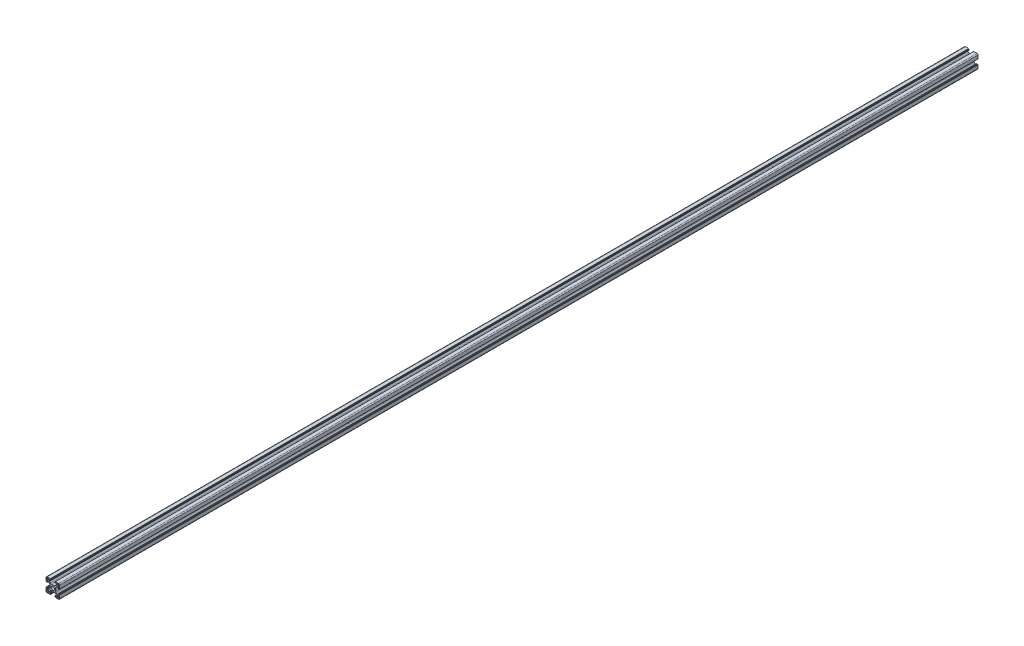
from build123d import *

# Parameters (mm, degrees)
EXTRUDE_1_DEPTH = 1350


with BuildPart() as part:
    # Эскиз1 → Бобышка-Вытянуть1 (new body)
    with BuildSketch(Plane.XY):
        with BuildLine():
            Line((-34.993325654, 64.172801362), (-33.094544985, 64.172801362))
            ThreePointArc((-33.094544985, 64.172801362), (-32.32917812, 64.325042297), (-31.680331423, 64.758587799))
            Line((-31.680331423, 64.758587799), (-30.379112092, 66.05980713))
            ThreePointArc((-30.379112092, 66.05980713), (-29.945566589, 66.708653828), (-29.793325654, 67.474020692))
            Line((-29.793325654, 67.474020692), (-29.793325654, 68.372801362))
            ThreePointArc((-29.793325654, 68.372801362), (-29.939772264, 68.726354752), (-30.293325654, 68.872801362))
            Line((-30.293325654, 68.872801362), (-30.396218873, 68.872801362))
            ThreePointArc((-30.396218873, 68.872801362), (-30.587560589, 68.834741128), (-30.749772264, 68.726354752))
            Line((-30.749772264, 68.726354752), (-31.23010235, 68.246024666))
            ThreePointArc((-31.23010235, 68.246024666), (-31.311208187, 68.191831478), (-31.406879045, 68.172801362))
            Line((-31.406879045, 68.172801362), (-31.693325654, 68.172801362))
            ThreePointArc((-31.693325654, 68.172801362), (-31.87010235, 68.246024666), (-31.943325654, 68.422801362))
            Line((-31.943325654, 68.422801362), (-31.943325654, 69.571872182))
            ThreePointArc((-31.943325654, 69.571872182), (-31.899391671, 69.677938199), (-31.793325654, 69.721872182))
            Line((-31.793325654, 69.721872182), (-31.293325654, 69.721872182))
            Line((-31.293325654, 69.721872182), (-31.293325654, 70.022801362))
            ThreePointArc((-31.293325654, 70.022801362), (-31.249391671, 70.128867379), (-31.143325654, 70.172801362))
            Line((-31.143325654, 70.172801362), (-26.493325654, 70.172801362))
            ThreePointArc((-26.493325654, 70.172801362), (-25.432665483, 69.733461533), (-24.993325654, 68.672801362))
            Line((-24.993325654, 68.672801362), (-24.993325654, 64.022801362))
            ThreePointArc((-24.993325654, 64.022801362), (-25.037259637, 63.916735344), (-25.143325654, 63.872801362))
            Line((-25.143325654, 63.872801362), (-25.444254834, 63.872801362))
            Line((-25.444254834, 63.872801362), (-25.444254834, 63.372801362))
            ThreePointArc((-25.444254834, 63.372801362), (-25.488188817, 63.266735344), (-25.594254834, 63.222801362))
            Line((-25.594254834, 63.222801362), (-26.743325654, 63.222801362))
            ThreePointArc((-26.743325654, 63.222801362), (-26.92010235, 63.296024666), (-26.993325654, 63.472801362))
            Line((-26.993325654, 63.472801362), (-26.993325654, 63.759247971))
            ThreePointArc((-26.993325654, 63.759247971), (-26.974295537, 63.854918829), (-26.92010235, 63.936024666))
            Line((-26.92010235, 63.936024666), (-26.439772264, 64.416354752))
            ThreePointArc((-26.439772264, 64.416354752), (-26.331385888, 64.578566427), (-26.293325654, 64.769908143))
            Line((-26.293325654, 64.769908143), (-26.293325654, 64.872801362))
            ThreePointArc((-26.293325654, 64.872801362), (-26.439772264, 65.226354752), (-26.793325654, 65.372801362))
            Line((-26.793325654, 65.372801362), (-27.692106323, 65.372801362))
            ThreePointArc((-27.692106323, 65.372801362), (-28.457473188, 65.220560427), (-29.106319886, 64.787014924))
            Line((-29.106319886, 64.787014924), (-30.407539217, 63.485795593))
            ThreePointArc((-30.407539217, 63.485795593), (-30.841084719, 62.836948895), (-30.993325654, 62.071582031))
            Line((-30.993325654, 62.071582031), (-30.993325654, 60.172801362))
            Line((-30.993325654, 60.172801362), (-30.993325654, 58.274020692))
            ThreePointArc((-30.993325654, 58.274020692), (-30.841084719, 57.508653828), (-30.407539217, 56.85980713))
            Line((-30.407539217, 56.85980713), (-29.106319886, 55.558587799))
            ThreePointArc((-29.106319886, 55.558587799), (-28.457473188, 55.125042297), (-27.692106323, 54.972801362))
            Line((-27.692106323, 54.972801362), (-26.793325654, 54.972801362))
            ThreePointArc((-26.793325654, 54.972801362), (-26.439772264, 55.119247971), (-26.293325654, 55.472801362))
            Line((-26.293325654, 55.472801362), (-26.293325654, 55.57569458))
            ThreePointArc((-26.293325654, 55.57569458), (-26.331385888, 55.767036297), (-26.439772264, 55.929247971))
            Line((-26.439772264, 55.929247971), (-26.92010235, 56.409578057))
            ThreePointArc((-26.92010235, 56.409578057), (-26.974295537, 56.490683894), (-26.993325654, 56.586354752))
            Line((-26.993325654, 56.586354752), (-26.993325654, 56.872801362))
            ThreePointArc((-26.993325654, 56.872801362), (-26.92010235, 57.049578057), (-26.743325654, 57.122801362))
            Line((-26.743325654, 57.122801362), (-25.594254834, 57.122801362))
            ThreePointArc((-25.594254834, 57.122801362), (-25.488188817, 57.078867379), (-25.444254834, 56.972801362))
            Line((-25.444254834, 56.972801362), (-25.444254834, 56.472801362))
            Line((-25.444254834, 56.472801362), (-25.143325654, 56.472801362))
            ThreePointArc((-25.143325654, 56.472801362), (-25.037259637, 56.428867379), (-24.993325654, 56.322801362))
            Line((-24.993325654, 56.322801362), (-24.993325654, 51.672801362))
            ThreePointArc((-24.993325654, 51.672801362), (-25.432665483, 50.61214119), (-26.493325654, 50.172801362))
            Line((-26.493325654, 50.172801362), (-31.143325654, 50.172801362))
            ThreePointArc((-31.143325654, 50.172801362), (-31.249391671, 50.216735344), (-31.293325654, 50.322801362))
            Line((-31.293325654, 50.322801362), (-31.293325654, 50.623730541))
            Line((-31.293325654, 50.623730541), (-31.793325654, 50.623730541))
            ThreePointArc((-31.793325654, 50.623730541), (-31.899391671, 50.667664524), (-31.943325654, 50.773730541))
            Line((-31.943325654, 50.773730541), (-31.943325654, 51.922801362))
            ThreePointArc((-31.943325654, 51.922801362), (-31.87010235, 52.099578057), (-31.693325654, 52.172801362))
            Line((-31.693325654, 52.172801362), (-31.406879045, 52.172801362))
            ThreePointArc((-31.406879045, 52.172801362), (-31.311208187, 52.153771245), (-31.23010235, 52.099578057))
            Line((-31.23010235, 52.099578057), (-30.749772264, 51.619247971))
            ThreePointArc((-30.749772264, 51.619247971), (-30.587560589, 51.510861595), (-30.396218873, 51.472801362))
            Line((-30.396218873, 51.472801362), (-30.293325654, 51.472801362))
            ThreePointArc((-30.293325654, 51.472801362), (-29.939772264, 51.619247971), (-29.793325654, 51.972801362))
            Line((-29.793325654, 51.972801362), (-29.793325654, 52.871582031))
            ThreePointArc((-29.793325654, 52.871582031), (-29.945566589, 53.636948895), (-30.379112092, 54.285795593))
            Line((-30.379112092, 54.285795593), (-31.680331423, 55.587014924))
            ThreePointArc((-31.680331423, 55.587014924), (-32.32917812, 56.020560427), (-33.094544985, 56.172801362))
            Line((-33.094544985, 56.172801362), (-34.993325654, 56.172801362))
            Line((-34.993325654, 56.172801362), (-36.892106323, 56.172801362))
            ThreePointArc((-36.892106323, 56.172801362), (-37.657473188, 56.020560427), (-38.306319886, 55.587014924))
            Line((-38.306319886, 55.587014924), (-39.607539217, 54.285795593))
            ThreePointArc((-39.607539217, 54.285795593), (-40.041084719, 53.636948895), (-40.193325654, 52.871582031))
            Line((-40.193325654, 52.871582031), (-40.193325654, 51.972801362))
            ThreePointArc((-40.193325654, 51.972801362), (-40.046879045, 51.619247971), (-39.693325654, 51.472801362))
            Line((-39.693325654, 51.472801362), (-39.590432436, 51.472801362))
            ThreePointArc((-39.590432436, 51.472801362), (-39.399090719, 51.510861595), (-39.236879045, 51.619247971))
            Line((-39.236879045, 51.619247971), (-38.756548959, 52.099578057))
            ThreePointArc((-38.756548959, 52.099578057), (-38.675443122, 52.153771245), (-38.579772264, 52.172801362))
            Line((-38.579772264, 52.172801362), (-38.293325654, 52.172801362))
            ThreePointArc((-38.293325654, 52.172801362), (-38.116548959, 52.099578057), (-38.043325654, 51.922801362))
            Line((-38.043325654, 51.922801362), (-38.043325654, 50.773730541))
            ThreePointArc((-38.043325654, 50.773730541), (-38.087259637, 50.667664524), (-38.193325654, 50.623730541))
            Line((-38.193325654, 50.623730541), (-38.693325654, 50.623730541))
            Line((-38.693325654, 50.623730541), (-38.693325654, 50.322801362))
            ThreePointArc((-38.693325654, 50.322801362), (-38.737259637, 50.216735344), (-38.843325654, 50.172801362))
            Line((-38.843325654, 50.172801362), (-43.493325654, 50.172801362))
            ThreePointArc((-43.493325654, 50.172801362), (-44.553985826, 50.61214119), (-44.993325654, 51.672801362))
            Line((-44.993325654, 51.672801362), (-44.993325654, 56.322801362))
            ThreePointArc((-44.993325654, 56.322801362), (-44.949391671, 56.428867379), (-44.843325654, 56.472801362))
            Line((-44.843325654, 56.472801362), (-44.542396475, 56.472801362))
            Line((-44.542396475, 56.472801362), (-44.542396475, 56.972801362))
            ThreePointArc((-44.542396475, 56.972801362), (-44.498462492, 57.078867379), (-44.392396475, 57.122801362))
            Line((-44.392396475, 57.122801362), (-43.243325654, 57.122801362))
            ThreePointArc((-43.243325654, 57.122801362), (-43.066548959, 57.049578057), (-42.993325654, 56.872801362))
            Line((-42.993325654, 56.872801362), (-42.993325654, 56.586354752))
            ThreePointArc((-42.993325654, 56.586354752), (-43.012355771, 56.490683894), (-43.066548959, 56.409578057))
            Line((-43.066548959, 56.409578057), (-43.546879045, 55.929247971))
            ThreePointArc((-43.546879045, 55.929247971), (-43.655265421, 55.767036297), (-43.693325654, 55.57569458))
            Line((-43.693325654, 55.57569458), (-43.693325654, 55.472801362))
            ThreePointArc((-43.693325654, 55.472801362), (-43.546879045, 55.119247971), (-43.193325654, 54.972801362))
            Line((-43.193325654, 54.972801362), (-42.294544985, 54.972801362))
            ThreePointArc((-42.294544985, 54.972801362), (-41.52917812, 55.125042297), (-40.880331423, 55.558587799))
            Line((-40.880331423, 55.558587799), (-39.579112092, 56.85980713))
            ThreePointArc((-39.579112092, 56.85980713), (-39.145566589, 57.508653828), (-38.993325654, 58.274020692))
            Line((-38.993325654, 58.274020692), (-38.993325654, 60.172801362))
            Line((-38.993325654, 60.172801362), (-38.993325654, 62.071582031))
            ThreePointArc((-38.993325654, 62.071582031), (-39.145566589, 62.836948895), (-39.579112092, 63.485795593))
            Line((-39.579112092, 63.485795593), (-40.880331423, 64.787014924))
            ThreePointArc((-40.880331423, 64.787014924), (-41.52917812, 65.220560427), (-42.294544985, 65.372801362))
            Line((-42.294544985, 65.372801362), (-43.193325654, 65.372801362))
            ThreePointArc((-43.193325654, 65.372801362), (-43.546879045, 65.226354752), (-43.693325654, 64.872801362))
            Line((-43.693325654, 64.872801362), (-43.693325654, 64.769908143))
            ThreePointArc((-43.693325654, 64.769908143), (-43.655265421, 64.578566427), (-43.546879045, 64.416354752))
            Line((-43.546879045, 64.416354752), (-43.066548959, 63.936024666))
            ThreePointArc((-43.066548959, 63.936024666), (-43.012355771, 63.854918829), (-42.993325654, 63.759247971))
            Line((-42.993325654, 63.759247971), (-42.993325654, 63.472801362))
            ThreePointArc((-42.993325654, 63.472801362), (-43.066548959, 63.296024666), (-43.243325654, 63.222801362))
            Line((-43.243325654, 63.222801362), (-44.392396475, 63.222801362))
            ThreePointArc((-44.392396475, 63.222801362), (-44.498462492, 63.266735344), (-44.542396475, 63.372801362))
            Line((-44.542396475, 63.372801362), (-44.542396475, 63.872801362))
            Line((-44.542396475, 63.872801362), (-44.843325654, 63.872801362))
            ThreePointArc((-44.843325654, 63.872801362), (-44.949391671, 63.916735344), (-44.993325654, 64.022801362))
            Line((-44.993325654, 64.022801362), (-44.993325654, 68.672801362))
            ThreePointArc((-44.993325654, 68.672801362), (-44.553985826, 69.733461533), (-43.493325654, 70.172801362))
            Line((-43.493325654, 70.172801362), (-38.843325654, 70.172801362))
            ThreePointArc((-38.843325654, 70.172801362), (-38.737259637, 70.128867379), (-38.693325654, 70.022801362))
            Line((-38.693325654, 70.022801362), (-38.693325654, 69.721872182))
            Line((-38.693325654, 69.721872182), (-38.193325654, 69.721872182))
            ThreePointArc((-38.193325654, 69.721872182), (-38.087259637, 69.677938199), (-38.043325654, 69.571872182))
            Line((-38.043325654, 69.571872182), (-38.043325654, 68.422801362))
            ThreePointArc((-38.043325654, 68.422801362), (-38.116548959, 68.246024666), (-38.293325654, 68.172801362))
            Line((-38.293325654, 68.172801362), (-38.579772264, 68.172801362))
            ThreePointArc((-38.579772264, 68.172801362), (-38.675443122, 68.191831478), (-38.756548959, 68.246024666))
            Line((-38.756548959, 68.246024666), (-39.236879045, 68.726354752))
            ThreePointArc((-39.236879045, 68.726354752), (-39.399090719, 68.834741128), (-39.590432436, 68.872801362))
            Line((-39.590432436, 68.872801362), (-39.693325654, 68.872801362))
            ThreePointArc((-39.693325654, 68.872801362), (-40.046879045, 68.726354752), (-40.193325654, 68.372801362))
            Line((-40.193325654, 68.372801362), (-40.193325654, 67.474020692))
            ThreePointArc((-40.193325654, 67.474020692), (-40.041084719, 66.708653828), (-39.607539217, 66.05980713))
            Line((-39.607539217, 66.05980713), (-38.306319886, 64.758587799))
            ThreePointArc((-38.306319886, 64.758587799), (-37.657473188, 64.325042297), (-36.892106323, 64.172801362))
            Line((-36.892106323, 64.172801362), (-34.993325654, 64.172801362))
        make_face()
        with BuildLine():
            Line((-28.093325654, 66.272801362), (-26.693325654, 66.272801362))
            ThreePointArc((-26.693325654, 66.272801362), (-26.127640229, 66.507115937), (-25.893325654, 67.072801362))
            Line((-25.893325654, 67.072801362), (-25.893325654, 68.472801362))
            ThreePointArc((-25.893325654, 68.472801362), (-26.127640229, 69.038486787), (-26.693325654, 69.272801362))
            Line((-26.693325654, 69.272801362), (-28.093325654, 69.272801362))
            ThreePointArc((-28.093325654, 69.272801362), (-28.659011079, 69.038486787), (-28.893325654, 68.472801362))
            Line((-28.893325654, 68.472801362), (-28.893325654, 67.072801362))
            ThreePointArc((-28.893325654, 67.072801362), (-28.659011079, 66.507115937), (-28.093325654, 66.272801362))
        make_face(mode=Mode.SUBTRACT)
        with BuildLine():
            Line((-28.893325654, 53.272801362), (-28.893325654, 51.872801362))
            ThreePointArc((-28.893325654, 51.872801362), (-28.659011079, 51.307115937), (-28.093325654, 51.072801362))
            Line((-28.093325654, 51.072801362), (-26.693325654, 51.072801362))
            ThreePointArc((-26.693325654, 51.072801362), (-26.127640229, 51.307115937), (-25.893325654, 51.872801362))
            Line((-25.893325654, 51.872801362), (-25.893325654, 53.272801362))
            ThreePointArc((-25.893325654, 53.272801362), (-26.127640229, 53.838486787), (-26.693325654, 54.072801362))
            Line((-26.693325654, 54.072801362), (-28.093325654, 54.072801362))
            ThreePointArc((-28.093325654, 54.072801362), (-28.659011079, 53.838486787), (-28.893325654, 53.272801362))
        make_face(mode=Mode.SUBTRACT)
        with BuildLine():
            Line((-41.893325654, 54.072801362), (-43.293325654, 54.072801362))
            ThreePointArc((-43.293325654, 54.072801362), (-43.859011079, 53.838486787), (-44.093325654, 53.272801362))
            Line((-44.093325654, 53.272801362), (-44.093325654, 51.872801362))
            ThreePointArc((-44.093325654, 51.872801362), (-43.859011079, 51.307115937), (-43.293325654, 51.072801362))
            Line((-43.293325654, 51.072801362), (-41.893325654, 51.072801362))
            ThreePointArc((-41.893325654, 51.072801362), (-41.327640229, 51.307115937), (-41.093325654, 51.872801362))
            Line((-41.093325654, 51.872801362), (-41.093325654, 53.272801362))
            ThreePointArc((-41.093325654, 53.272801362), (-41.327640229, 53.838486787), (-41.893325654, 54.072801362))
        make_face(mode=Mode.SUBTRACT)
        with BuildLine():
            Line((-41.093325654, 67.072801362), (-41.093325654, 68.472801362))
            ThreePointArc((-41.093325654, 68.472801362), (-41.327640229, 69.038486787), (-41.893325654, 69.272801362))
            Line((-41.893325654, 69.272801362), (-43.293325654, 69.272801362))
            ThreePointArc((-43.293325654, 69.272801362), (-43.859011079, 69.038486787), (-44.093325654, 68.472801362))
            Line((-44.093325654, 68.472801362), (-44.093325654, 67.072801362))
            ThreePointArc((-44.093325654, 67.072801362), (-43.859011079, 66.507115937), (-43.293325654, 66.272801362))
            Line((-43.293325654, 66.272801362), (-41.893325654, 66.272801362))
            ThreePointArc((-41.893325654, 66.272801362), (-41.327640229, 66.507115937), (-41.093325654, 67.072801362))
        make_face(mode=Mode.SUBTRACT)
        with BuildLine():
            ThreePointArc((-32.493325654, 60.172801362), (-33.225558701, 61.940568315), (-34.993325654, 62.672801362))
            ThreePointArc((-34.993325654, 62.672801362), (-36.761092607, 61.940568315), (-37.493325654, 60.172801362))
            ThreePointArc((-37.493325654, 60.172801362), (-36.761092607, 58.405034409), (-34.993325654, 57.672801362))
            ThreePointArc((-34.993325654, 57.672801362), (-33.225558701, 58.405034409), (-32.493325654, 60.172801362))
        make_face(mode=Mode.SUBTRACT)
    extrude(amount=EXTRUDE_1_DEPTH)


solid = part.part
